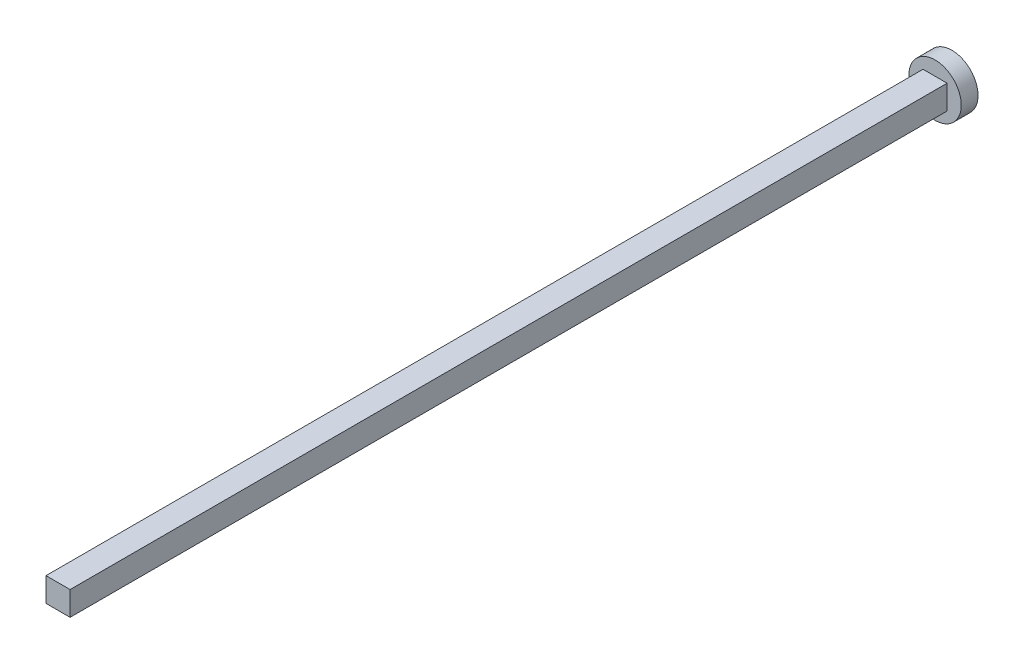
from build123d import *

# Parameters (mm, degrees)
SKETCH1_W           = 2.86759605
SKETCH1_H           = 2.86759605
BOSS_EXTRUDE1_DEPTH = 104.37
SKETCH2_R           = 3.116187631
BOSS_EXTRUDE2_DEPTH = 2


with BuildPart() as part:
    # Sketch1 → Boss-Extrude1 (new body)
    with BuildSketch(Plane.XY):
        Rectangle(SKETCH1_W, SKETCH1_H)
    extrude(amount=BOSS_EXTRUDE1_DEPTH)

    # Sketch2 → Boss-Extrude2 (add)
    with BuildSketch(Plane(origin=(0, 0, 0), x_dir=(-1, 0, 0), z_dir=(0, 0, -1))):
        Circle(SKETCH2_R)
    extrude(amount=BOSS_EXTRUDE2_DEPTH)


solid = part.part
